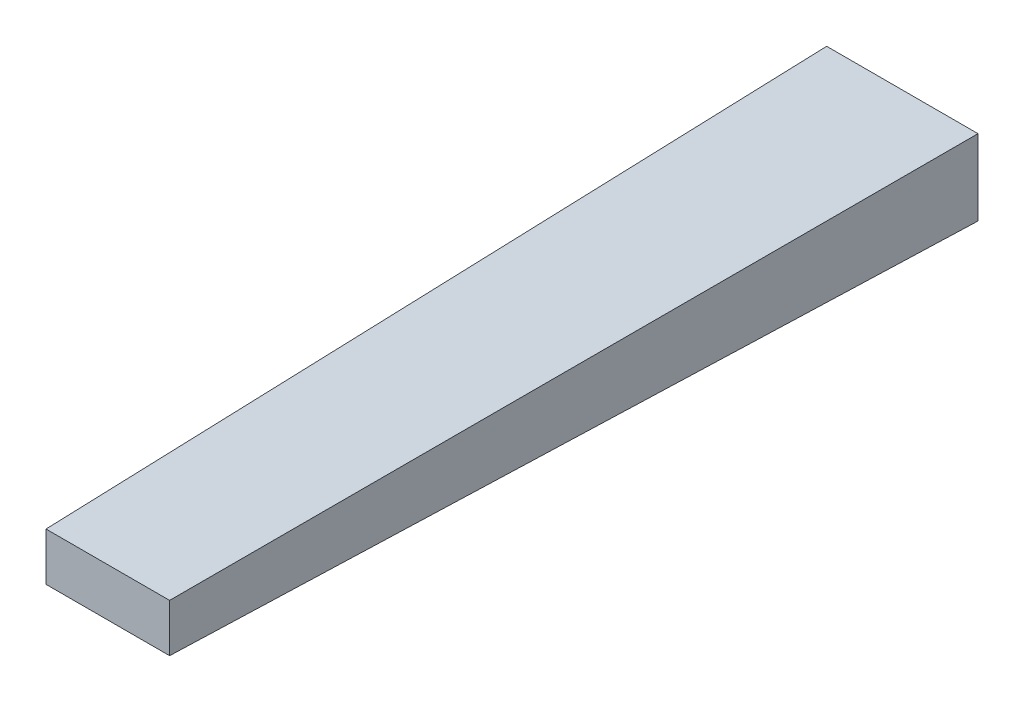
from build123d import *

# Parameters (mm, degrees)
SKETCH2_W           = 200
SKETCH2_H           = 100
BOSS_EXTRUDE1_DEPTH = 1050
BOSS_EXTRUDE1_TAPER = 1


with BuildPart() as part:
    # Sketch2 → Boss-Extrude1 (new body)
    with BuildSketch(Plane.XY):
        Rectangle(SKETCH2_W, SKETCH2_H)
    extrude(amount=BOSS_EXTRUDE1_DEPTH, taper=BOSS_EXTRUDE1_TAPER)


solid = part.part
